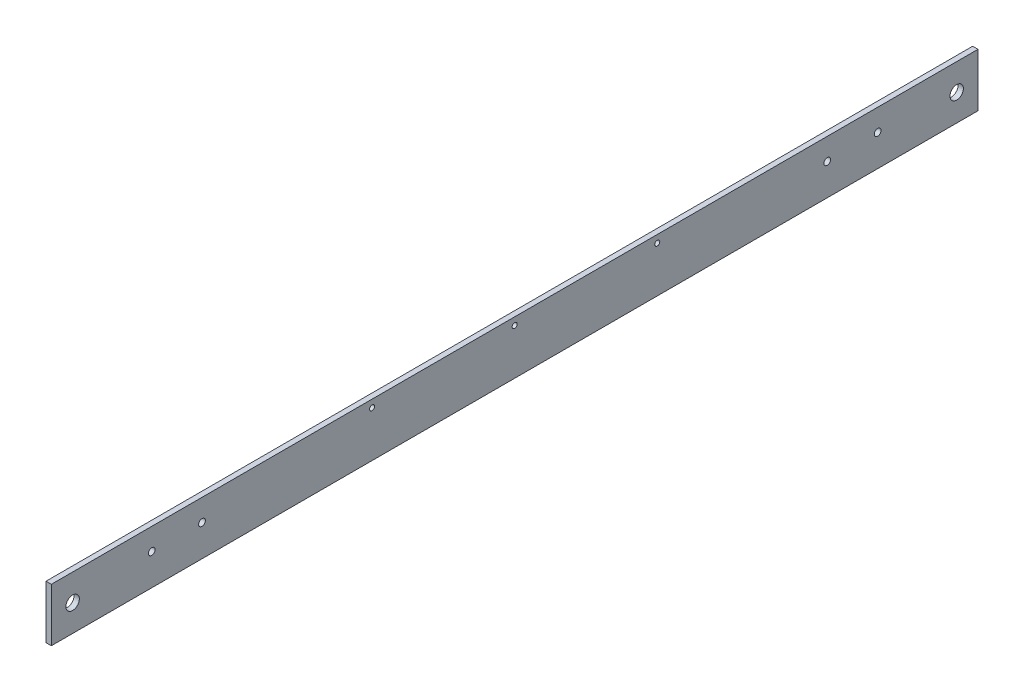
from build123d import *

# Parameters (mm, degrees)
SKETCH1_W                                 = 552.45
SKETCH1_H                                 = 31.75
SKETCH1_R                                 = 4
SKETCH1_R_2                               = 2
BOSS_EXTRUDE2_DEPTH                       = 3.175
SKETCH2_R                                 = 1.5
LIGHTINGGUIDEMOUNTHOLESCUT_EXTRUDE1_DEPTH = 554.370712656


with BuildPart() as part:
    # Sketch1 → Boss-Extrude2 (new body)
    with BuildSketch(Plane(origin=(0, 0, 0), x_dir=(0, 0, -1), z_dir=(1, 0, 0))):
        with Locations((276.225, 15.875)):
            Rectangle(SKETCH1_W, SKETCH1_H)
        with Locations((12.7, 15.875)):
            Circle(SKETCH1_R, mode=Mode.SUBTRACT)
        with Locations((539.75, 15.875)):
            Circle(SKETCH1_R, mode=Mode.SUBTRACT)
        with Locations((462.625, 18.75)):
            Circle(SKETCH1_R_2, mode=Mode.SUBTRACT)
        with Locations((492.625, 18.75)):
            Circle(SKETCH1_R_2, mode=Mode.SUBTRACT)
        with Locations((59.825, 18.75)):
            Circle(SKETCH1_R_2, mode=Mode.SUBTRACT)
        with Locations((89.825, 18.75)):
            Circle(SKETCH1_R_2, mode=Mode.SUBTRACT)
    extrude(amount=BOSS_EXTRUDE2_DEPTH)

    # Sketch2 → LightingGuideMountHolesCut-Extrude1 (cut, through all)
    with BuildSketch(Plane(origin=(3.175, 0, 0), x_dir=(0, 0, -1), z_dir=(1, 0, 0))):
        with Locations((191.225, 27.25)):
            Circle(SKETCH2_R)
        with Locations((276.225, 27.25)):
            Circle(SKETCH2_R)
        with Locations((361.225, 27.25)):
            Circle(SKETCH2_R)
    extrude(amount=-LIGHTINGGUIDEMOUNTHOLESCUT_EXTRUDE1_DEPTH, mode=Mode.SUBTRACT)


solid = part.part
